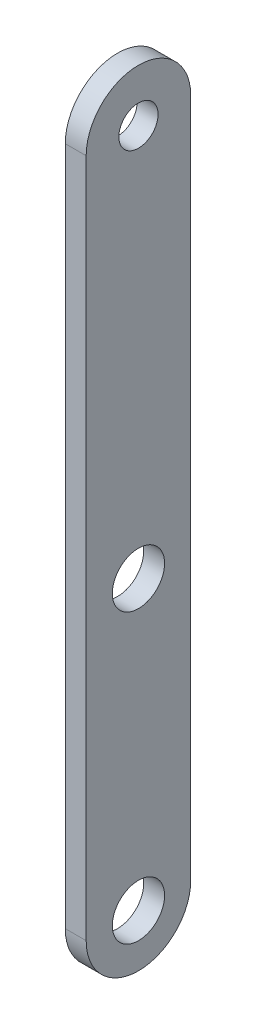
from build123d import *

# Parameters (mm, degrees)
BOSS_EXTRUDE1_DEPTH      = 4
BOSS_EXTRUDE1_DEPTH_BACK = 4
SKETCH2_R                = 10
SKETCH2_R_2              = 7.5


with BuildPart() as part:
    # Sketch2 → Boss-Extrude1 (new, two sides: drawn at the far end of the back side and taken through both)
    with BuildSketch(Plane(origin=(0, 0, 0), x_dir=(0, 0, -1), z_dir=(1, 0, 0)).offset(-BOSS_EXTRUDE1_DEPTH_BACK)):
        with BuildLine():
            ThreePointArc((20, 0), (0, 20), (-20, 0))
            Line((-20, 0), (-20, -260))
            ThreePointArc((-20, -260), (0, -280), (20, -260))
            Line((20, -260), (20, 0))
        make_face()
        with Locations((0, -260)):
            Circle(SKETCH2_R, mode=Mode.SUBTRACT)
        with Locations((0, -150)):
            Circle(SKETCH2_R, mode=Mode.SUBTRACT)
        Circle(SKETCH2_R_2, mode=Mode.SUBTRACT)
    extrude(amount=BOSS_EXTRUDE1_DEPTH + BOSS_EXTRUDE1_DEPTH_BACK)


solid = part.part
